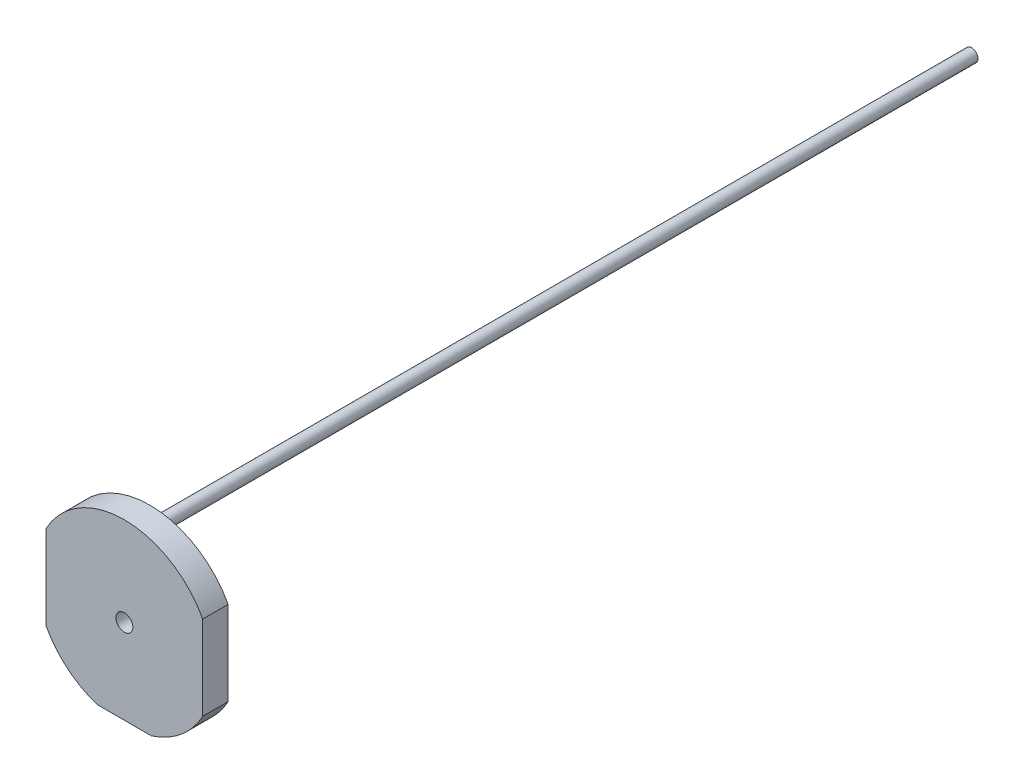
from build123d import *

# Parameters (mm, degrees)
SKETCH_4_R      = 2
SKETCH_4_R_2    = 1.5
EXTRUDE_1_DEPTH = 6
SKETCH_4_2_R    = 1.5
EXTRUDE_2_DEPTH = 200


with BuildPart() as part:
    # 草图4 → 凸台-拉伸1 (new body)
    with BuildSketch(Plane.XY):
        with BuildLine():
            Line((-18.5, 9.937303457), (-18.5, -9.937303457))
            ThreePointArc((-18.5, -9.937303457), (-13.429663608, -16.144476931), (-6.403124237, -20))
            Line((-6.403124237, -20), (6.403124237, -20))
            ThreePointArc((6.403124237, -20), (13.429663608, -16.144476931), (18.5, -9.937303457))
            Line((18.5, -9.937303457), (18.5, 9.937303457))
            ThreePointArc((18.5, 9.937303457), (0, 21), (-18.5, 9.937303457))
        make_face()
        Circle(SKETCH_4_R, mode=Mode.SUBTRACT)
        with Locations((0, 16)):
            Circle(SKETCH_4_R_2, mode=Mode.SUBTRACT)
    extrude(amount=-EXTRUDE_1_DEPTH)

    # 草图4<2> → 凸台-拉伸2 (add)
    with BuildSketch(Plane.XY):
        with Locations((0, 16)):
            Circle(SKETCH_4_2_R)
    extrude(amount=-EXTRUDE_2_DEPTH)


solid = part.part
